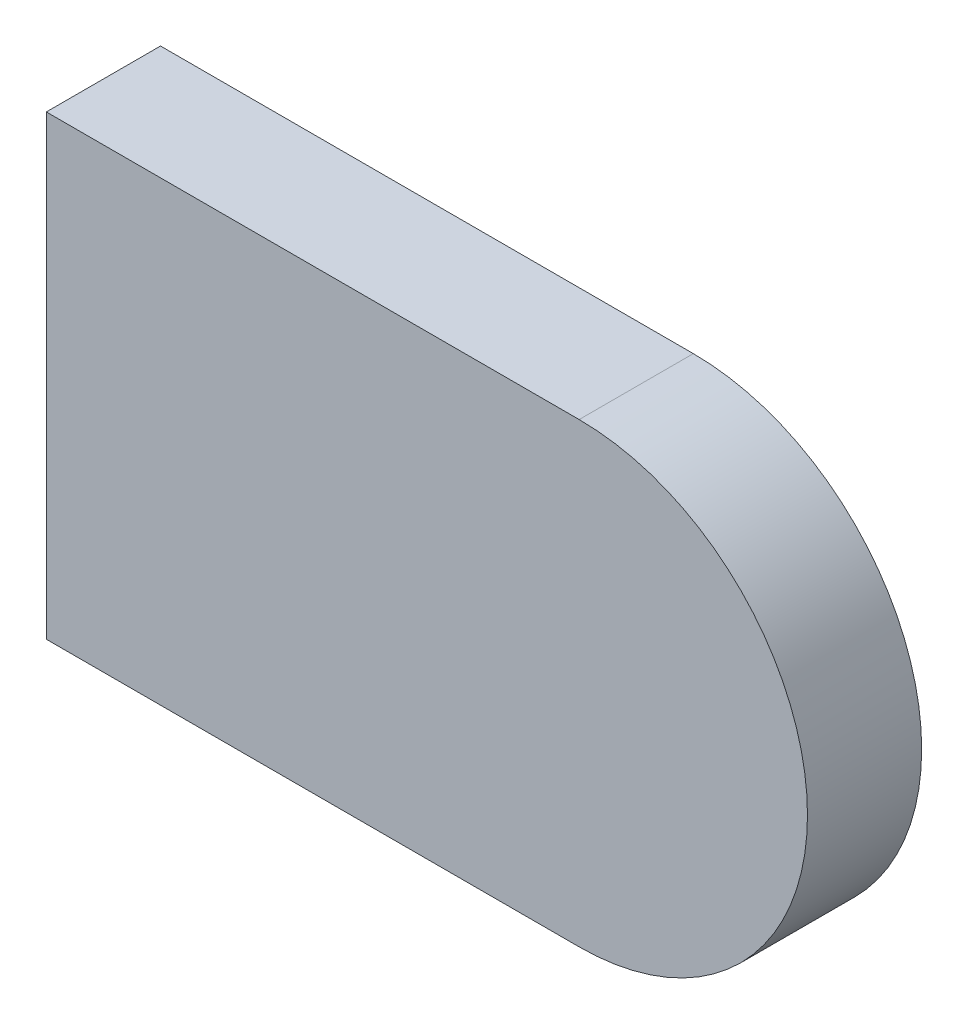
from build123d import *

# Parameters (mm, degrees)
BOSS_EXTRUDE1_DEPTH = 19.05


with BuildPart() as part:
    # Sketch1 → Boss-Extrude1 (new body)
    with BuildSketch(Plane.XY):
        with BuildLine():
            Line((0, 0), (88.903356144, 0))
            ThreePointArc((88.903356144, 0), (115.837719997, 11.159557314), (126.996625166, 38.094191625))
            ThreePointArc((126.996625166, 38.094191625), (115.840640047, 65.037521475), (88.9, 76.199999999))
            Line((88.9, 76.199999999), (0, 76.199999999))
            Line((0, 76.199999999), (0, 0))
        make_face()
    extrude(amount=BOSS_EXTRUDE1_DEPTH)


solid = part.part
